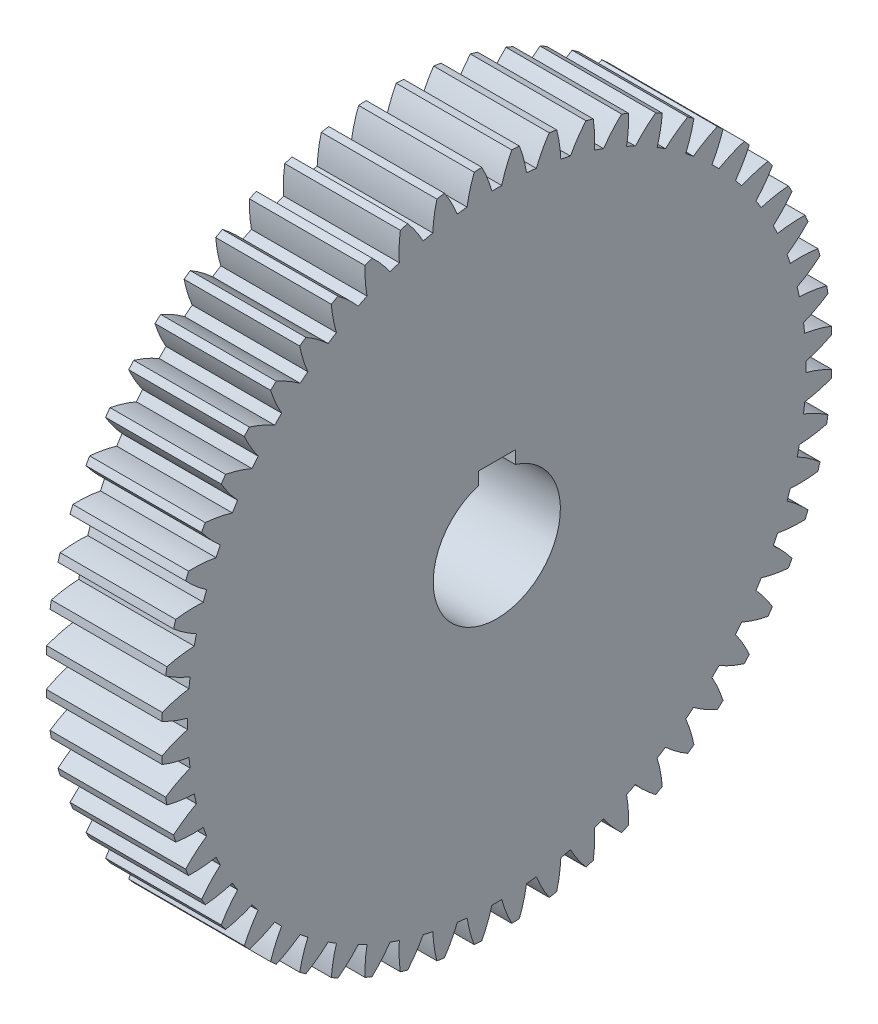
from build123d import *

# Parameters (mm, degrees)
BASPROSKE_W     = 50
BASPROSKE_H     = 145
TOOTHCUT_DEPTH  = 212.068709192
TEETHCUTS_COUNT = 56
TEETHCUTS_ANGLE = 353.571428571
BORSKE_R        = 27.5
BORE_DEPTH      = 50.0000508
KEYSKE_W        = 16
KEYSKE_H        = 31.8
KEYWAY_DEPTH    = 50.0000508


with BuildPart() as part:
    # BasProSke → Base-Revolve (revolve)
    with BuildSketch(Plane(origin=(0, 0, 0), x_dir=(1, 0, 0), z_dir=(0, 1, 0)), mode=Mode.PRIVATE) as base_revolve_sk:
        with Locations((25, 72.5)):
            Rectangle(BASPROSKE_W, BASPROSKE_H)
    revolve(base_revolve_sk.sketch.rotate(Axis((-10, 0, 0), (1, 0, 0)), 180), axis=Axis((-10, 0, 0), (1, 0, 0)))

    # TooCutSke → ToothCut (cut, through all)
    with BuildSketch(Plane(origin=(0, 0, 0), x_dir=(0, 0, -1), z_dir=(1, 0, 0))):
        with BuildLine():
            ThreePointArc((2.126883665, 133.732088023), (0, 133.749), (-2.126883665, 133.732088023))
            ThreePointArc((-2.126883665, 133.732088023), (-4.0144259, 139.423098046), (-6.49960614, 144.879680305))
            ThreePointArc((-6.49960614, 144.879680305), (0, 145.0254), (6.49960614, 144.879680305))
            ThreePointArc((6.49960614, 144.879680305), (4.0144259, 139.423098046), (2.126883665, 133.732088023))
        make_face()
    toothcut = extrude(amount=TOOTHCUT_DEPTH, mode=Mode.SUBTRACT)

    # TeethCuts: ToothCut ×56 about axis
    teethcuts_axis = Axis((-10, 0, 0), (1, 0, 0))
    for i in range(1, TEETHCUTS_COUNT):
        add(toothcut.rotate(teethcuts_axis, i * TEETHCUTS_ANGLE / (TEETHCUTS_COUNT - 1)), mode=Mode.SUBTRACT)

    # BorSke → Bore (cut, symmetric)
    with BuildSketch(Plane(origin=(0, 0, 0), x_dir=(0, 0, -1), z_dir=(1, 0, 0))):
        with Locations(Location((0, 0, 0), (0, 0, 180))):
            Circle(BORSKE_R)
    extrude(amount=BORE_DEPTH, both=True, mode=Mode.SUBTRACT)

    # KeySke → Keyway (cut, symmetric)
    with BuildSketch(Plane(origin=(0, 0, 0), x_dir=(0, 0, -1), z_dir=(1, 0, 0))):
        with Locations((0, 15.9)):
            Rectangle(KEYSKE_W, KEYSKE_H)
    extrude(amount=KEYWAY_DEPTH, both=True, mode=Mode.SUBTRACT)


solid = part.part
